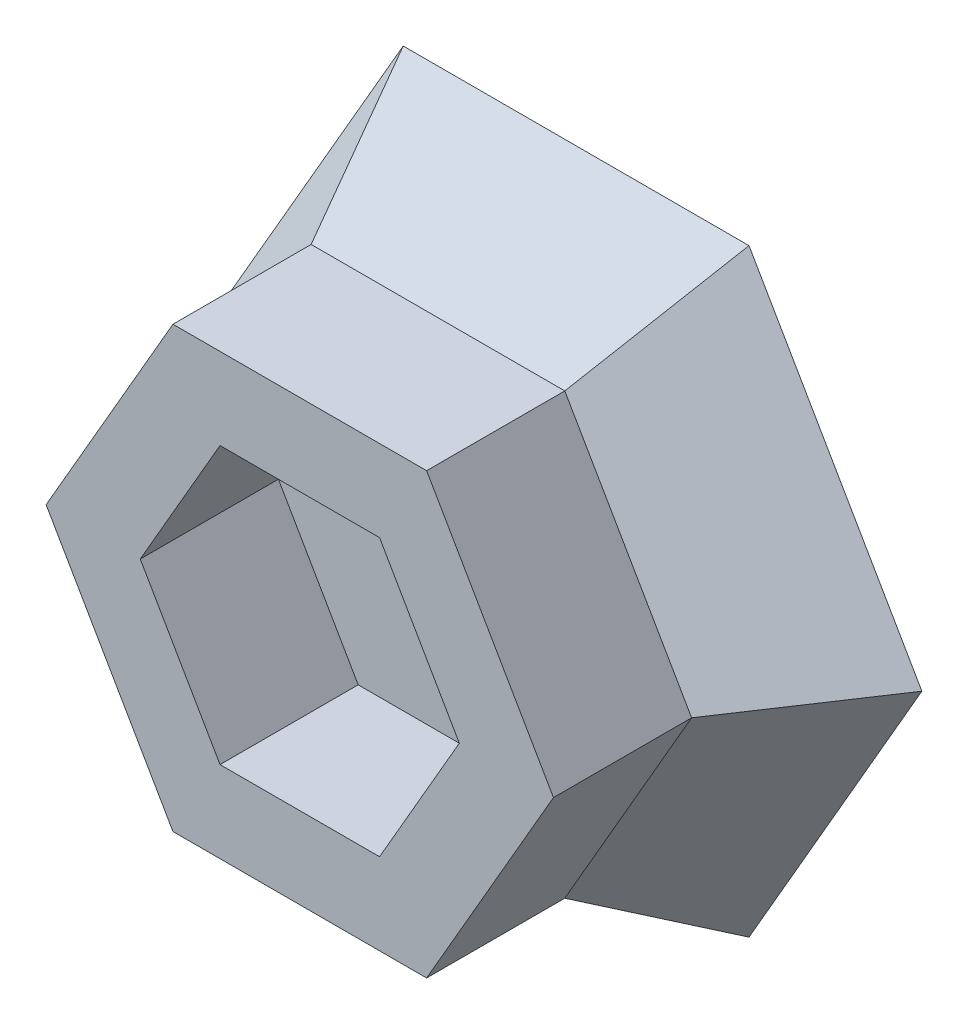
from build123d import *

# Parameters (mm, degrees)
BOSS_EXTRUDE1_DEPTH = 5
BOSS_EXTRUDE2_DEPTH = 5
BOSS_EXTRUDE2_DRAFT = 30


with BuildPart() as part:
    # Sketch1 → Boss-Extrude1 (new body)
    with BuildSketch(Plane.XY):
        Polygon((9.17986928, 0), (4.58993464, 7.95), (-4.58993464, 7.95), (-9.17986928, 0), (-4.58993464, -7.95), (4.58993464, -7.95), align=None)
        Polygon((5.773502692, 0), (2.886751346, 5), (-2.886751346, 5), (-5.773502692, 0), (-2.886751346, -5), (2.886751346, -5), align=None, mode=Mode.SUBTRACT)
    extrude(amount=BOSS_EXTRUDE1_DEPTH)


with BuildPart() as boss_extrude2_tool:
    # Sketch1<2> → Boss-Extrude2 (with draft: the straight prism first)
    with BuildSketch(Plane.XY):
        Polygon((4.58993464, -7.95), (9.17986928, 0), (4.58993464, 7.95), (-4.58993464, 7.95), (-9.17986928, 0), (-4.58993464, -7.95), align=None)
    extrude(amount=-BOSS_EXTRUDE2_DEPTH)
    # Boss-Extrude2: the draft: its side faces are tilted about the plane it starts from
    boss_extrude2_sides = [boss_extrude2_tool.faces().sort_by_distance(p)[0] for p in [
        (6.88490196, -3.975, -2.5),
        (6.88490196, 3.975, -2.5),
        (0, 7.95, -2.5),
        (-6.88490196, 3.975, -2.5),
        (-6.88490196, -3.975, -2.5),
        (0, -7.95, -2.5),
    ]]
    draft(boss_extrude2_sides, Plane.XY, BOSS_EXTRUDE2_DRAFT)


with BuildPart() as part_1:
    add(part.part)

    # Boss-Extrude2: add boss_extrude2_tool
    add(boss_extrude2_tool.part)


solid = part_1.part
